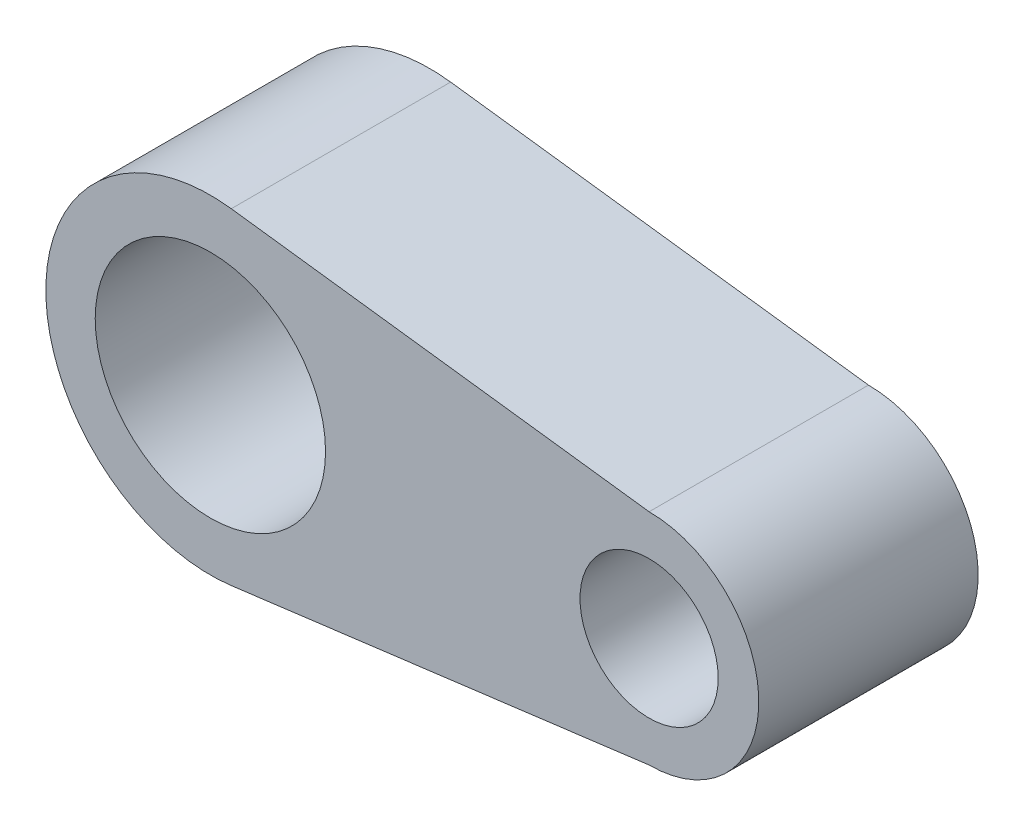
from build123d import *

# Parameters (mm, degrees)
SKETCH1_R           = 5.25
SKETCH1_R_2         = 3.15
BOSS_EXTRUDE1_DEPTH = 10


with BuildPart() as part:
    # Sketch1 → Boss-Extrude1 (new body)
    with BuildSketch(Plane.XY):
        with BuildLine():
            ThreePointArc((0.952688438, 7.439246248), (-7.5, 0), (0.952688438, -7.439246248))
            Line((0.952688438, -7.439246248), (20, -5))
            ThreePointArc((20, -5), (25, 0), (20, 5))
            Line((20, 5), (0.952688438, 7.439246248))
        make_face()
        Circle(SKETCH1_R, mode=Mode.SUBTRACT)
        with Locations((20, 0)):
            Circle(SKETCH1_R_2, mode=Mode.SUBTRACT)
    extrude(amount=BOSS_EXTRUDE1_DEPTH)


solid = part.part
